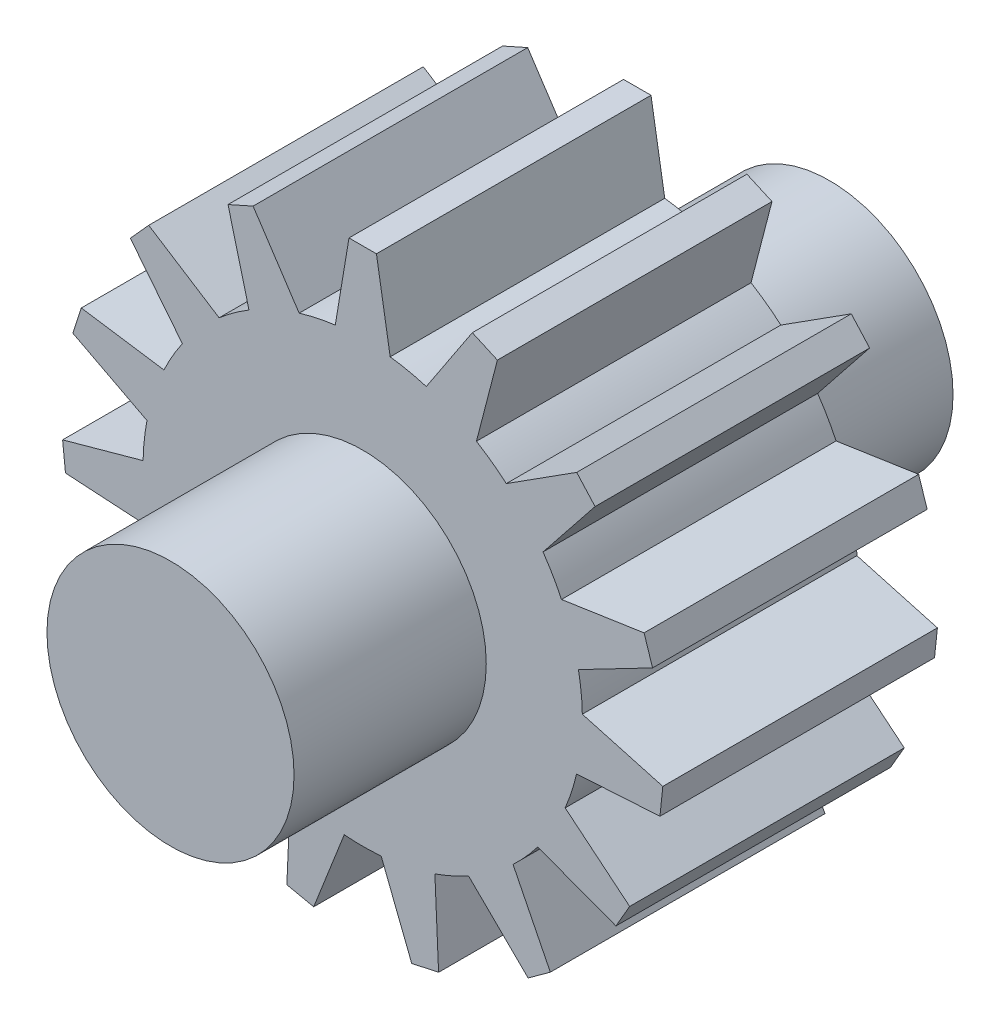
from build123d import *

# Parameters (mm, degrees)
SKETCH1_R           = 8
BOSS_EXTRUDE1_DEPTH = 10
BOSS_EXTRUDE2_DEPTH = 10
SKETCH3_R           = 4.5
BOSS_EXTRUDE3_DEPTH = 7
SKETCH3_2_R         = 4.5
BOSS_EXTRUDE4_DEPTH = 7
BOSS_EXTRUDE5_START = 7
SKETCH4_R           = 4.5
BOSS_EXTRUDE5_DEPTH = 7
SKETCH5_R           = 3
CUT_EXTRUDE9_DEPTH  = 7


with BuildPart() as part:
    # Sketch1 → Boss-Extrude1 (new body)
    with BuildSketch(Plane.XY):
        Circle(SKETCH1_R)
    extrude(amount=BOSS_EXTRUDE1_DEPTH)

    # Sketch2 → Boss-Extrude2 (add)
    with BuildSketch(Plane.XY.offset(10)):
        Polygon((-1, 7.937253933), (-0.5, 10.937253933), (0.5, 10.937253933), (1, 7.937253933), align=None)
        Polygon((2.314826562, 7.65777892), (3.99180922, 10.195046971), (4.905354678, 9.788310328), (4.141917478, 6.844305634), align=None)
        Polygon((5.229398583, 6.054204363), (7.793398362, 7.690023769), (8.462528969, 6.946878943), (6.567659795, 4.567914712), align=None)
        Polygon((7.23976008, 3.40380287), (10.247438126, 3.855325595), (10.556455121, 2.904269079), (7.857794069, 1.501689838), align=None)
        Polygon((7.998301289, 0.164852939), (10.929602743, -0.645993398), (10.82507428, -1.640515294), (7.789244362, -1.824190852), align=None)
        Polygon((7.373863542, -3.102601563), (9.721939754, -5.035614265), (9.221939754, -5.901639668), (6.373863542, -4.83465237), align=None)
        Polygon((5.4744178, -5.833588068), (6.83326506, -8.554531678), (6.024248065, -9.14231693), (3.856383811, -7.009158573), align=None)
        Polygon((2.628395486, -7.5558942), (2.763056759, -10.594292848), (1.784909158, -10.802204539), (0.672100285, -7.971717582), align=None)
        Polygon((-0.672100285, -7.971717582), (-1.784909158, -10.802204539), (-2.763056759, -10.594292848), (-2.628395486, -7.5558942), align=None)
        Polygon((-3.856383811, -7.009158573), (-6.024248065, -9.14231693), (-6.83326506, -8.554531678), (-5.4744178, -5.833588068), align=None)
        Polygon((-6.373863542, -4.83465237), (-9.221939754, -5.901639668), (-9.721939754, -5.035614265), (-7.373863542, -3.102601563), align=None)
        Polygon((-7.789244362, -1.824190852), (-10.82507428, -1.640515294), (-10.929602743, -0.645993398), (-7.998301289, 0.164852939), align=None)
        Polygon((-7.857794069, 1.501689838), (-10.556455121, 2.904269079), (-10.247438126, 3.855325595), (-7.23976008, 3.40380287), align=None)
        Polygon((-6.567659795, 4.567914712), (-8.462528969, 6.946878943), (-7.793398362, 7.690023769), (-5.229398583, 6.054204363), align=None)
        Polygon((-4.141917478, 6.844305634), (-4.905354678, 9.788310328), (-3.99180922, 10.195046971), (-2.314826562, 7.65777892), align=None)
    extrude(amount=-BOSS_EXTRUDE2_DEPTH)

    # Sketch3 → Boss-Extrude3 (add)
    with BuildSketch(Plane.XY.offset(10)):
        Circle(SKETCH3_R)
    extrude(amount=BOSS_EXTRUDE3_DEPTH)

    # Sketch3<2> → Boss-Extrude4 (add)
    with BuildSketch(Plane.XY.offset(10)):
        Circle(SKETCH3_2_R)
    extrude(amount=BOSS_EXTRUDE4_DEPTH)

    # Sketch4 → Boss-Extrude5 (add)
    with BuildSketch(Plane(origin=(0, 0, 0), x_dir=(-1, 0, 0), z_dir=(0, 0, -1)).offset(BOSS_EXTRUDE5_START)):
        with Locations(Location((0, 0, 0), (0, 0, 180))):
            Circle(SKETCH4_R)
    extrude(amount=-BOSS_EXTRUDE5_DEPTH)

    # Sketch5 → Cut-Extrude9 (cut)
    with BuildSketch(Plane(origin=(0, 0, -7), x_dir=(-1, 0, 0), z_dir=(0, 0, -1))):
        Circle(SKETCH5_R)
    extrude(amount=-CUT_EXTRUDE9_DEPTH, mode=Mode.SUBTRACT)


solid = part.part
